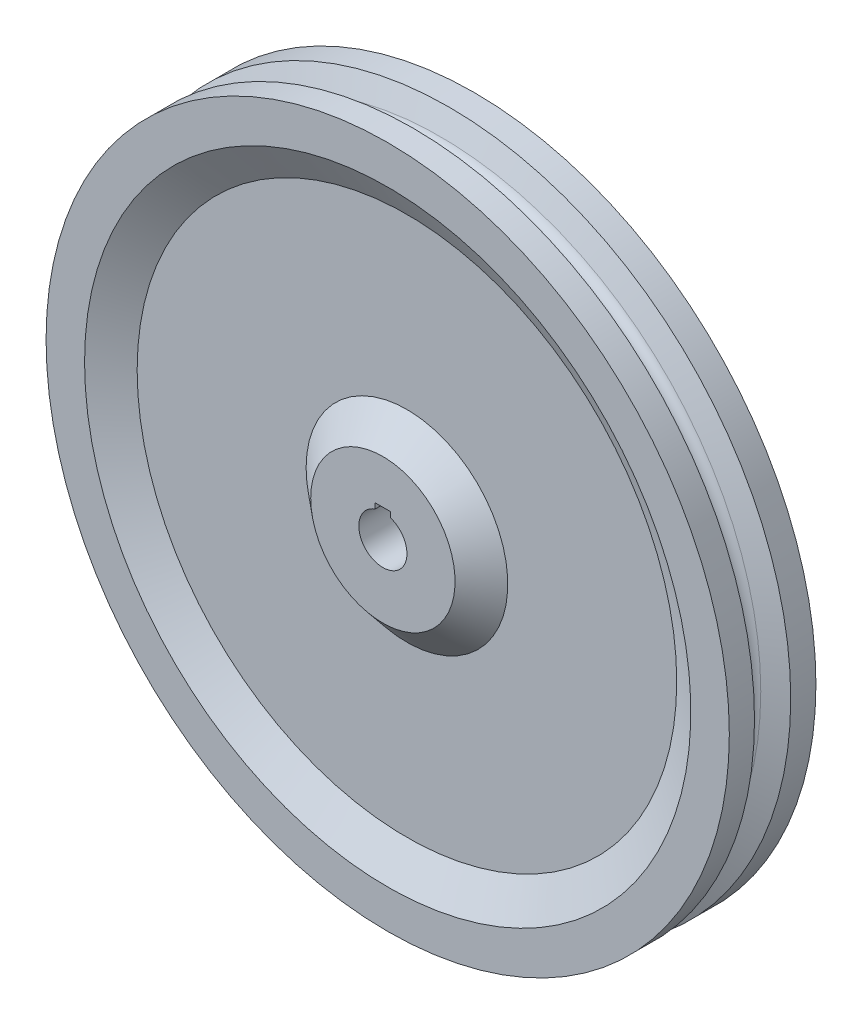
from build123d import *
from build123d.topology import SkipClean

# Parameters (mm, degrees)
ESQUISSE2_R             = 25
ENL_V_MAT_EXTRU_1_DEPTH = 512.908194894
ESQUISSE3_W             = 16
ESQUISSE3_H             = 8.6
ENL_V_MAT_EXTRU_2_DEPTH = 512.908194894


with BuildPart() as part:
    # Esquisse1 → Révolution1 (revolve)
    with BuildSketch(Plane(origin=(0, 0, 0), x_dir=(0, 0, -1), z_dir=(1, 0, 0)), mode=Mode.PRIVATE) as r_volution1_sk:
        with BuildLine():
            Line((0, 0), (-50, 0))
            Line((-50, 0), (-50, 75))
            Line((-50, 75), (-25, 104.793839815))
            Line((-25, 104.793839815), (-25, 280.358983849))
            Line((-25, 280.358983849), (-45, 315))
            Line((-45, 315), (-45, 355))
            Line((-45, 355), (-18.820962226, 355))
            Line((-18.820962226, 355), (-9.700735091, 332.98182396))
            ThreePointArc((-9.700735091, 332.98182396), (-5.833487447, 328.269569071), (0, 326.5))
            Line((0, 326.5), (0, 0))
        make_face()
    r_volution1 = revolve(r_volution1_sk.sketch.rotate(Axis((0, 0, 0), (0, 0, 1)), 90), axis=Axis((0, 0, 0), (0, 0, 1)))

    # Symétrie1: Révolution1 across plane
    with SkipClean():  # the faces are left unmerged after this step: merging them gives an invalid solid
        add(r_volution1.mirror(Plane(origin=(0, 326.5, 0), x_dir=(1, 0, 0), z_dir=(0, 0, -1))))

    # Esquisse2 → Enlèv. mat.-Extru.1 (cut, through all)
    with SkipClean():  # the faces are left unmerged after this step: merging them gives an invalid solid
        with BuildSketch(Plane.XY.offset(50)):
            Circle(ESQUISSE2_R)
        extrude(amount=-ENL_V_MAT_EXTRU_1_DEPTH, mode=Mode.SUBTRACT)

    # Esquisse3 → Enlèv. mat.-Extru.2 (cut, through all)
    with SkipClean():  # the faces are left unmerged after this step: merging them gives an invalid solid
        with BuildSketch(Plane.XY.offset(50)):
            with Locations((0, 25)):
                Rectangle(ESQUISSE3_W, ESQUISSE3_H)
        extrude(amount=-ENL_V_MAT_EXTRU_2_DEPTH, mode=Mode.SUBTRACT)


solid = part.part
